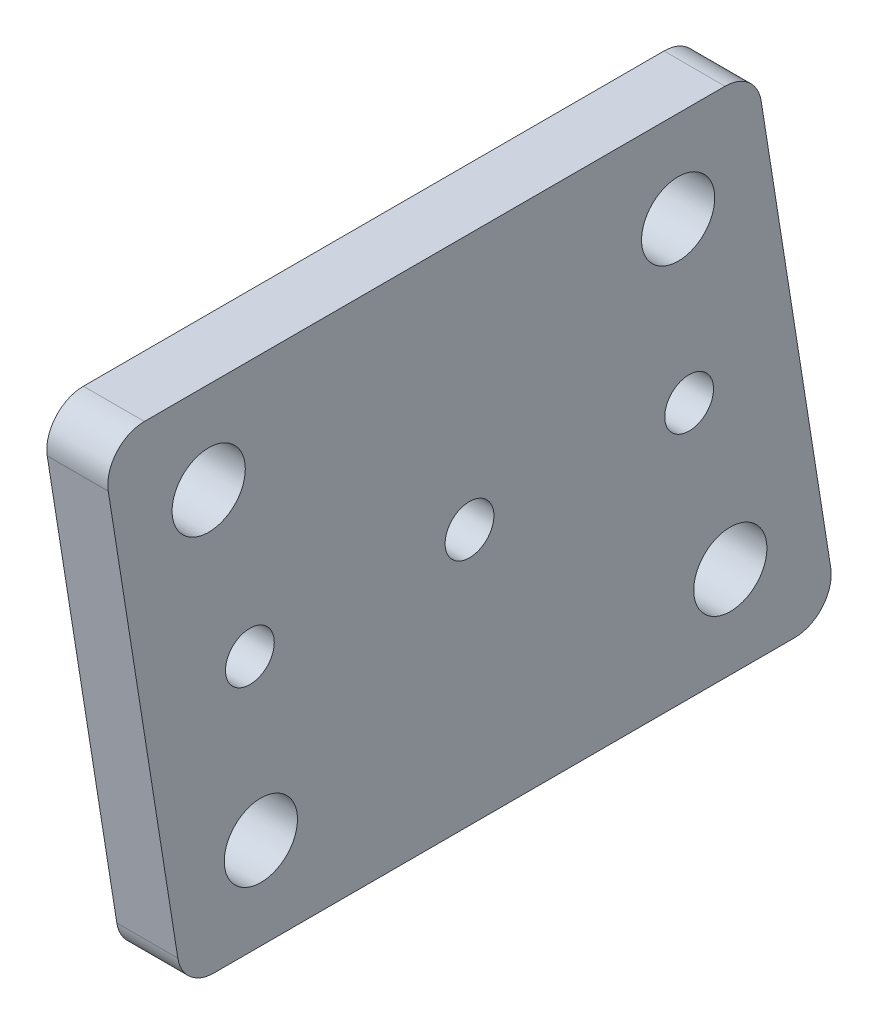
from build123d import *

# Parameters (mm, degrees)
SKETCH1_R           = 3
SKETCH1_R_2         = 2
BOSS_EXTRUDE1_DEPTH = 5
FILLET1_R           = 3


with BuildPart() as part:
    # Sketch1 → Boss-Extrude1 (new body)
    with BuildSketch(Plane(origin=(0, 0, 0), x_dir=(0, 0, -1), z_dir=(1, 0, 0))):
        Polygon((-6.405605141, -7.5), (47.255046526, -7.5), (40.602900032, 34.5), (-13.057751635, 34.5), align=None)
        Circle(SKETCH1_R, mode=Mode.SUBTRACT)
        with Locations((38.47367478, 0)):
            Circle(SKETCH1_R, mode=Mode.SUBTRACT)
        with Locations((-4.276379889, 27)):
            Circle(SKETCH1_R, mode=Mode.SUBTRACT)
        with Locations((34.197294891, 27)):
            Circle(SKETCH1_R, mode=Mode.SUBTRACT)
        with Locations((17.098647446, 13.5)):
            Circle(SKETCH1_R_2, mode=Mode.SUBTRACT)
        with Locations((-0.901352554, 13.5)):
            Circle(SKETCH1_R_2, mode=Mode.SUBTRACT)
        with Locations((35.098647446, 13.5)):
            Circle(SKETCH1_R_2, mode=Mode.SUBTRACT)
    extrude(amount=BOSS_EXTRUDE1_DEPTH)

    # Fillet1
    fillet1_edges = [part.edges().sort_by_distance(p)[0] for p in [
        (2.5, 34.5, 13.057751635),
        (2.5, 34.5, -40.602900032),
        (2.5, -7.5, -47.255046526),
        (2.5, -7.5, 6.405605141),
    ]]
    fillet(fillet1_edges, radius=FILLET1_R)


solid = part.part
